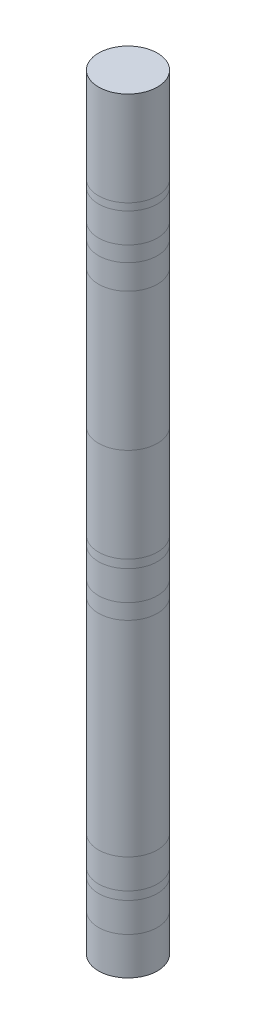
from build123d import *

# Parameters (mm, degrees)
SKETCH1_R           = 6.35
BOSS_EXTRUDE1_DEPTH = 165.1


with BuildPart() as part:
    # Sketch1 → Boss-Extrude1 (new body)
    with BuildSketch(Plane(origin=(0, 0, 0), x_dir=(1, 0, 0), z_dir=(0, 1, 0))):
        with Locations(Location((0, 0, 0), (0, 0, 270))):
            Circle(SKETCH1_R)
    extrude(amount=BOSS_EXTRUDE1_DEPTH)


solid = part.part
